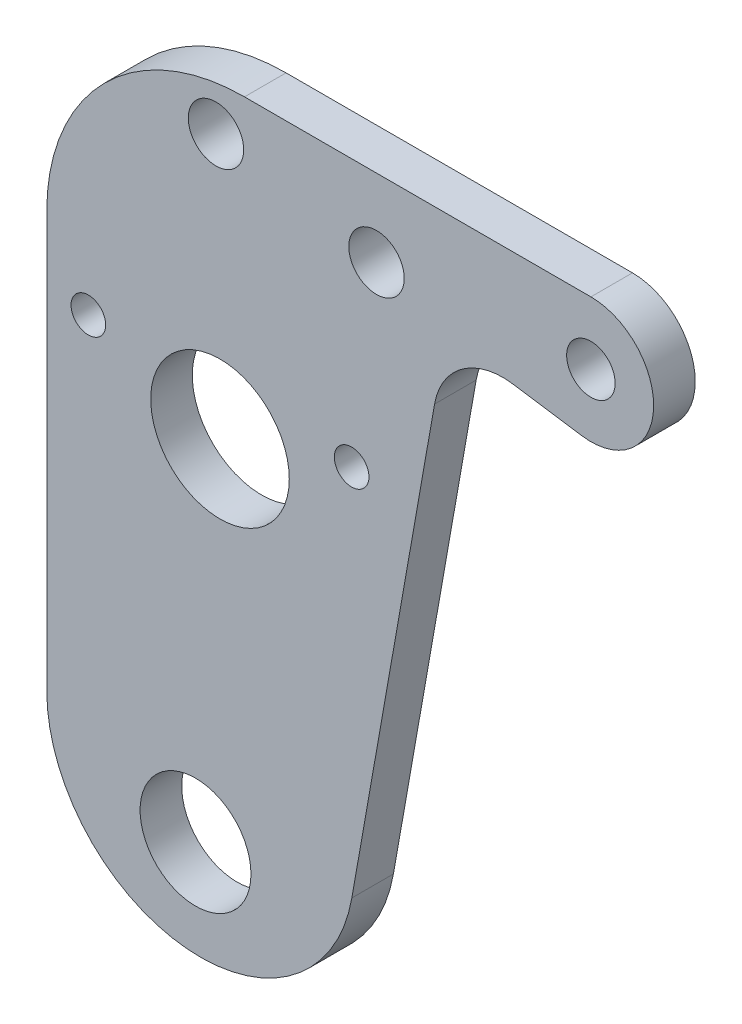
from build123d import *

# Parameters (mm, degrees)
SKETCH3_R           = 4
BOSS_EXTRUDE4_DEPTH = 3
SKETCH5_R           = 1.25
SKETCH5_R_2         = 5
CUT_EXTRUDE2_DEPTH  = 43.952434096
SKETCH6_R           = 1.75
CUT_EXTRUDE3_DEPTH  = 43.952434096
SKETCH8_R           = 2
CUT_EXTRUDE4_DEPTH  = 43.952434096


with BuildPart() as part:
    # Sketch3 → Boss-Extrude4 (new body)
    with BuildSketch(Plane.XY):
        with BuildLine():
            Line((-12.5, -15), (-12.5, 15))
            ThreePointArc((-12.5, 15), (-8.321357206, 25.088136105), (1.766778898, 29.266778898))
            Line((1.766778898, 29.266778898), (26.766778898, 29.266778898))
            ThreePointArc((26.766778898, 29.266778898), (31.28229963, 24.401899264), (26.095015576, 20.260756249))
            Line((26.095015576, 20.260756249), (21.150345096, 21.00253374))
            ThreePointArc((21.150345096, 21.00253374), (17.488439715, 20.116539535), (15.48452884, 16.926104149))
            Line((15.48452884, 16.926104149), (9.51547116, -16.926104149))
            ThreePointArc((9.51547116, -16.926104149), (-2.374739058, -26.049783342), (-12.5, -15))
        make_face()
        with Locations((-1.764648859, -19.076420455)):
            Circle(SKETCH3_R, mode=Mode.SUBTRACT)
    extrude(amount=BOSS_EXTRUDE4_DEPTH)

    # Sketch5 → Cut-Extrude2 (cut, through all)
    with BuildSketch(Plane.XY.offset(3)):
        with Locations((-9.5, 10)):
            Circle(SKETCH5_R)
        with Locations((9.5, 10)):
            Circle(SKETCH5_R)
        with Locations((0, 7)):
            Circle(SKETCH5_R_2)
    extrude(amount=-CUT_EXTRUDE2_DEPTH, mode=Mode.SUBTRACT)

    # Sketch6 → Cut-Extrude3 (cut, through all)
    with BuildSketch(Plane.XY.offset(3)):
        with Locations((26.766778898, 24.738714008)):
            Circle(SKETCH6_R)
    extrude(amount=-CUT_EXTRUDE3_DEPTH, mode=Mode.SUBTRACT)

    # Sketch8 → Cut-Extrude4 (cut, through all)
    with BuildSketch(Plane.XY.offset(3)):
        with Locations((11.295409365, 23.680851427)):
            Circle(SKETCH8_R)
        with Locations((-0.289384278, 25.919731906)):
            Circle(SKETCH8_R)
    extrude(amount=-CUT_EXTRUDE4_DEPTH, mode=Mode.SUBTRACT)


solid = part.part
